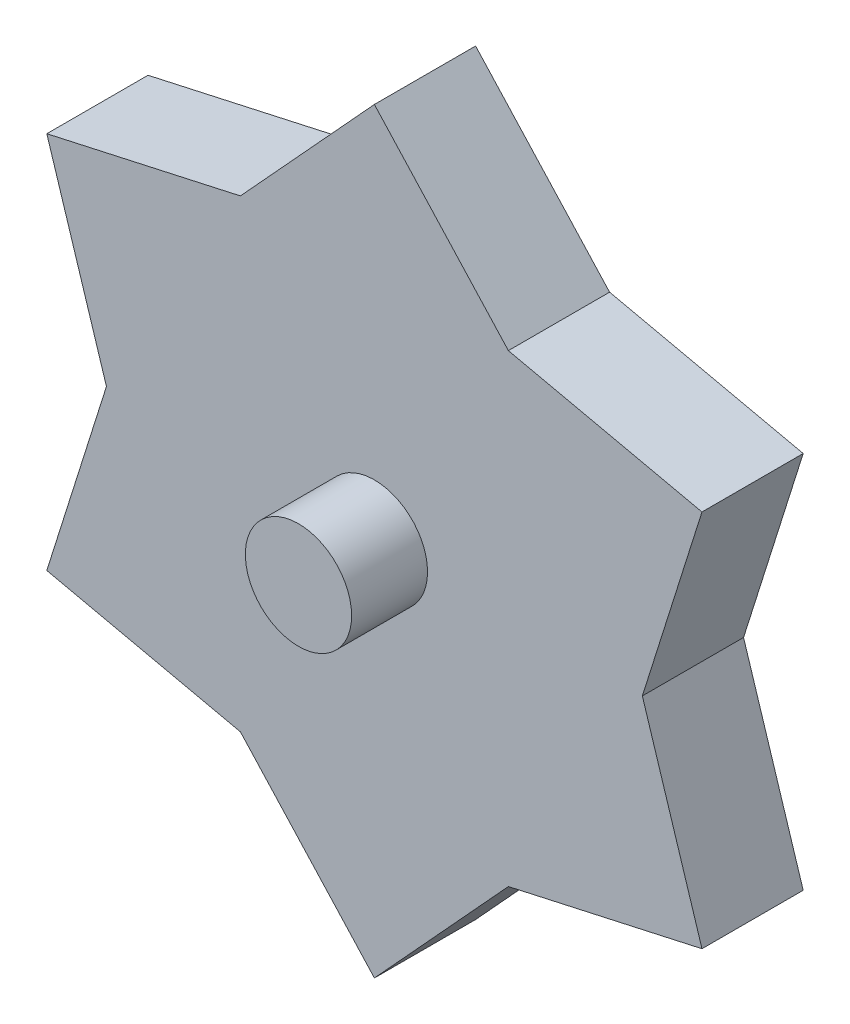
from build123d import *

# Parameters (mm, degrees)
BOSS_EXTRUDE1_DEPTH = 2
SKETCH1_4_R         = 1.05
BOSS_EXTRUDE2_DEPTH = 1.5


with BuildPart() as part:
    # Sketch1 → Boss-Extrude1 (new body)
    with BuildSketch(Plane.XY):
        Polygon((2.647536041, 4.585666938), (0, 7.474945526), (-2.647536041, 4.585666938), (-6.473492718, 3.737472763), (-5.295072082, 0), (-6.473492718, -3.737472763), (-2.647536041, -4.585666938), (0, -7.474945526), (2.647536041, -4.585666938), (6.473492718, -3.737472763), (5.295072082, 0), (6.473492718, 3.737472763), align=None)
    extrude(amount=-BOSS_EXTRUDE1_DEPTH)

    # Sketch1<4> → Boss-Extrude2 (add)
    with BuildSketch(Plane.XY):
        Circle(SKETCH1_4_R)
    extrude(amount=BOSS_EXTRUDE2_DEPTH)


solid = part.part
